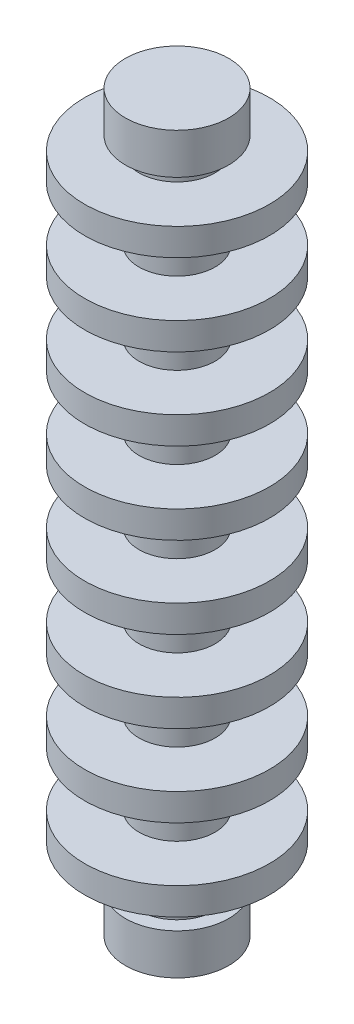
from build123d import *


with BuildPart() as part:
    # Sketch1 → Revolve1 (revolve)
    with BuildSketch(Plane.XY, mode=Mode.PRIVATE) as revolve1_sk:
        Polygon((2.8, 24), (2.8, 23), (6.8, 23), (6.8, 21), (2.8, 21), (2.8, 18), (2.8, 17), (6.8, 17), (6.8, 15), (2.8, 15), (2.8, 12), (2.8, 11), (6.8, 11), (6.8, 9), (2.8, 9), (2.8, 6), (2.8, 5), (6.8, 5), (6.8, 3), (2.8, 3), (2.8, 0), (2.8, -1), (6.8, -1), (6.8, -3), (2.8, -3), (2.8, -6), (2.8, -7), (6.8, -7), (6.8, -9), (2.8, -9), (2.8, -12), (2.8, -13), (6.8, -13), (6.8, -15), (2.8, -15), (2.8, -18), (2.8, -19), (6.8, -19), (6.8, -21), (2.8, -21), (2.8, -24), (3.8, -24), (3.8, -27), (0, -27), (0, 27), (3.8, 27), (3.8, 24), align=None)
    revolve(revolve1_sk.sketch.rotate(Axis((0, 27, 0), (0, -1, 0)), 180), axis=Axis((0, 27, 0), (0, -1, 0)))


solid = part.part
